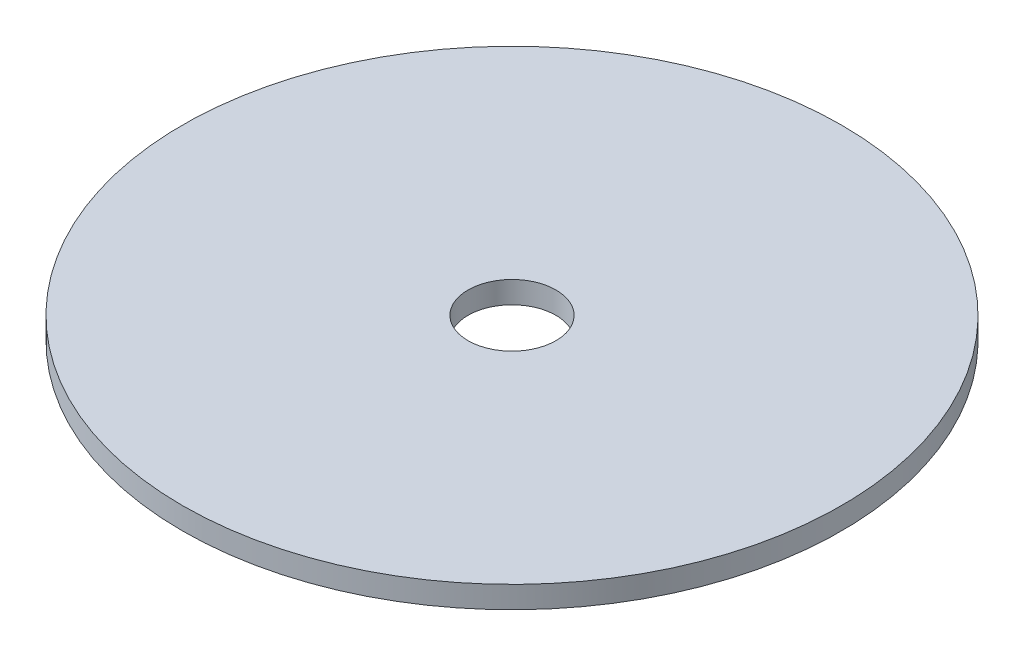
from build123d import *

# Parameters (mm, degrees)
SKETCH_1_R      = 75
SKETCH_1_R_2    = 10
EXTRUDE_1_DEPTH = 5


with BuildPart() as part:
    # 草圖1 → 填料-伸長1 (new body)
    with BuildSketch(Plane(origin=(0, 0, 0), x_dir=(1, 0, 0), z_dir=(0, 1, 0))):
        with Locations(Location((0, 0, 0), (0, 0, 270))):
            Circle(SKETCH_1_R)
        with Locations(Location((0, 0, 0), (0, 0, 270))):
            Circle(SKETCH_1_R_2, mode=Mode.SUBTRACT)
    extrude(amount=EXTRUDE_1_DEPTH)


solid = part.part
